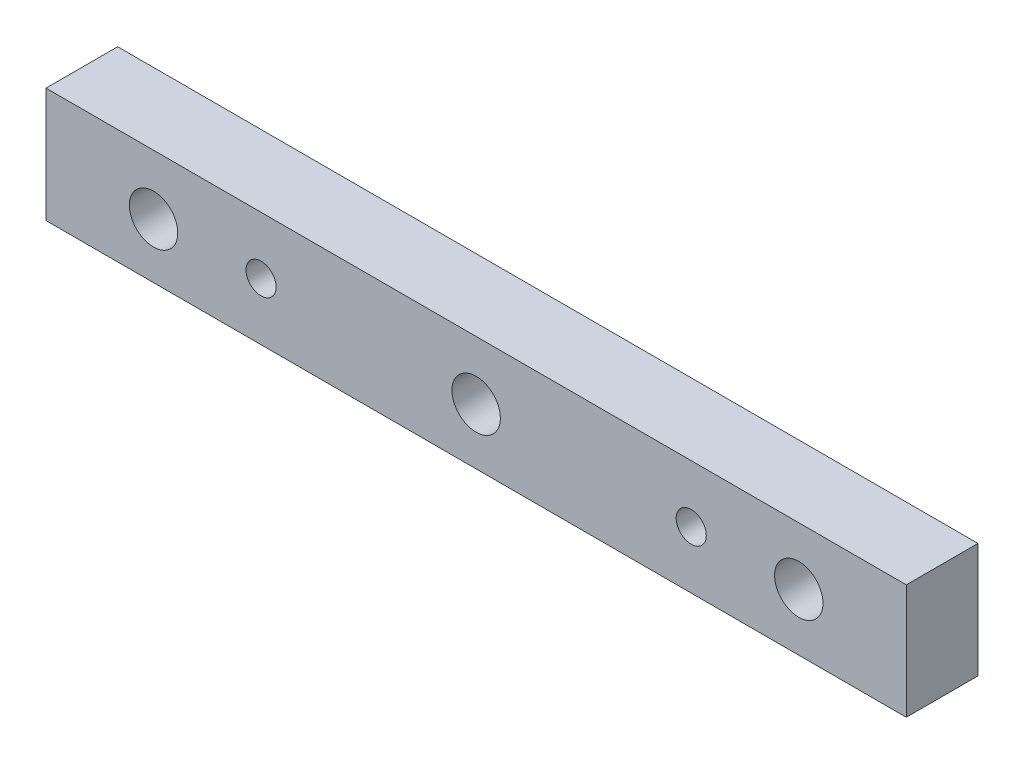
from build123d import *

# Parameters (mm, degrees)
CROQUIS1_W                                 = 120
CROQUIS1_H                                 = 16
SALIENTE_EXTRUIR1_DEPTH                    = 10
PERFORADOR_PARA_ROSCAR_PARA_MACHO_DE_ROS_D = 4.2
TALADRO_DE_MARGEN_PARA_1_41_D              = 6.7564


with BuildPart() as part:
    # Croquis1 → Saliente-Extruir1 (new body)
    with BuildSketch(Plane.XY):
        with Locations((20.530427632, 3.875)):
            Rectangle(CROQUIS1_W, CROQUIS1_H)
    extrude(amount=SALIENTE_EXTRUIR1_DEPTH)

    # Perforador para roscar para macho de roscar para M5x0.81 (through all)
    with Locations(Plane.XY.offset(10)):
        with Locations((-9.469572368, 3.875), (50.530427632, 3.875)):
            Hole(PERFORADOR_PARA_ROSCAR_PARA_MACHO_DE_ROS_D / 2)

    # Taladro de margen para 1/41 (through all)
    with Locations(Plane.XY.offset(10)):
        with Locations((-24.469572368, 3.554018425), (20.530427632, 3.691581957), (65.530427632, 3.829145489)):
            Hole(TALADRO_DE_MARGEN_PARA_1_41_D / 2)


solid = part.part
